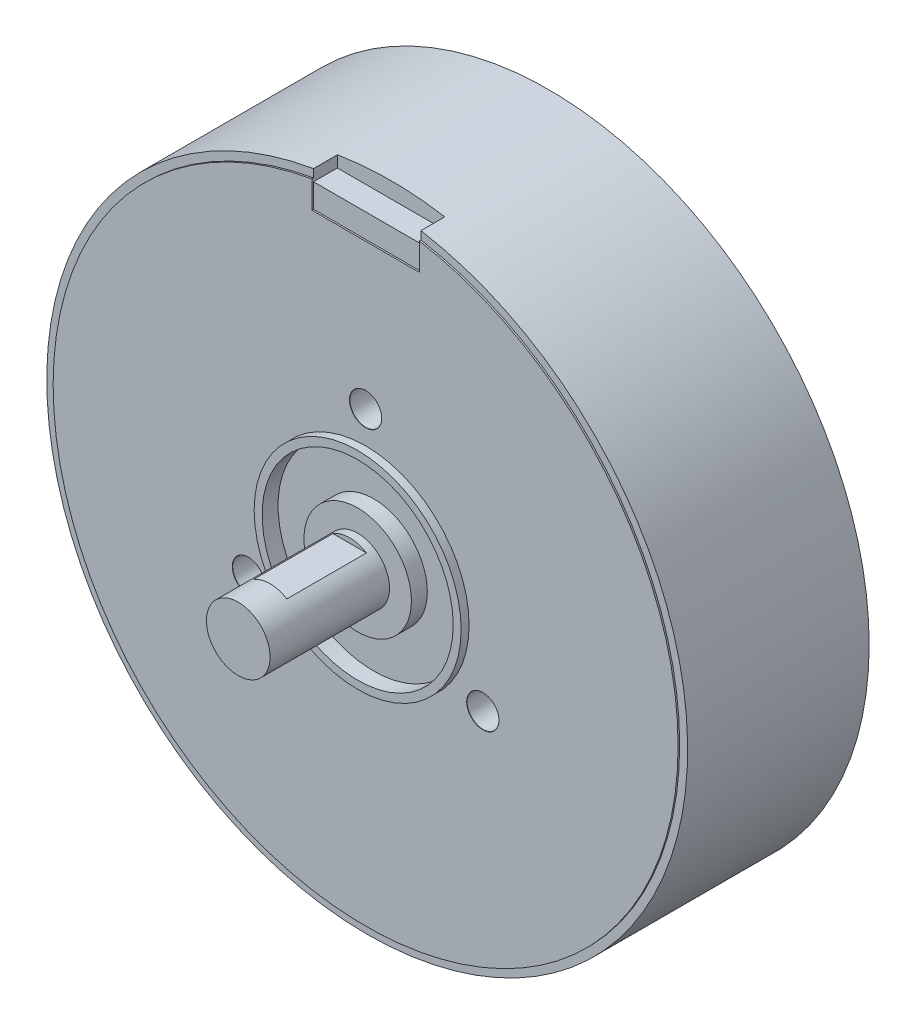
from build123d import *

# Parameters (mm, degrees)
SKETCH1_R                       = 40.25
BOSS_EXTRUDE1_DEPTH             = 23
SKETCH2_R                       = 12
CUT_EXTRUDE1_DEPTH              = 1
BOSS_EXTRUDE2_START             = 1
SKETCH3_R                       = 13
SKETCH3_R_2                     = 12
BOSS_EXTRUDE2_DEPTH             = 1
SKETCH4_R                       = 6.75
BOSS_EXTRUDE3_DEPTH             = 2
SKETCH7_R                       = 4
BOSS_EXTRUDE5_DEPTH             = 1
BOSS_EXTRUDE6_DEPTH             = 11
SKETCH8_R                       = 4
BOSS_EXTRUDE7_DEPTH             = 4
CUT_EXTRUDE2_START              = -0.2
SKETCH9_R                       = 40.25
SKETCH9_R_2                     = 39.25
CUT_EXTRUDE2_DEPTH              = 0.2
CUT_EXTRUDE4_START              = -0.2
CUT_EXTRUDE4_DEPTH              = 0.2
CUT_EXTRUDE5_START              = -3
CUT_EXTRUDE5_DEPTH              = 3
F_4_0MM_DOWEL_HOLE1_D           = 4
F_4_0MM_DOWEL_HOLE1_DEPTH       = 5.5
F_4_0MM_DOWEL_HOLE1_CSINK_D     = 4.05
F_4_0MM_DOWEL_HOLE1_CSINK_ANGLE = 90
F_4_0MM_DOWEL_HOLE1_TIP         = 1.201721238


with BuildPart() as part:
    # Sketch1 → Boss-Extrude1 (new body)
    with BuildSketch(Plane.XY):
        Circle(SKETCH1_R)
    extrude(amount=BOSS_EXTRUDE1_DEPTH)

    # Sketch2 → Cut-Extrude1 (cut)
    with BuildSketch(Plane.XY.offset(23)):
        Circle(SKETCH2_R)
    extrude(amount=-CUT_EXTRUDE1_DEPTH, mode=Mode.SUBTRACT)

    # Sketch3 → Boss-Extrude2 (add)
    with BuildSketch(Plane.XY.offset(23).offset(BOSS_EXTRUDE2_START)):
        Circle(SKETCH3_R)
        Circle(SKETCH3_R_2, mode=Mode.SUBTRACT)
    extrude(amount=-BOSS_EXTRUDE2_DEPTH)

    # Sketch4 → Boss-Extrude3 (add)
    with BuildSketch(Plane.XY.offset(22)):
        Circle(SKETCH4_R)
    extrude(amount=BOSS_EXTRUDE3_DEPTH)

    # Sketch7 → Boss-Extrude5 (add)
    with BuildSketch(Plane.XY.offset(24)):
        Circle(SKETCH7_R)
    extrude(amount=BOSS_EXTRUDE5_DEPTH)

    # Sketch5 → Boss-Extrude6 (add)
    with BuildSketch(Plane.XY.offset(24)):
        with BuildLine():
            Line((0, 0), (0, -4))
            ThreePointArc((0, -4), (2.828427125, -2.828427125), (4, 0))
            Line((4, 0), (0, 0))
        make_face()
        with BuildLine():
            Line((0, 3.4), (0, 0))
            Line((0, 0), (4, 0))
            ThreePointArc((4, 0), (3.494890771, 1.945697433), (2.107130751, 3.4))
            Line((2.107130751, 3.4), (0, 3.4))
        make_face()
        with BuildLine():
            Line((-3.4, 0), (0, 0))
            Line((0, 0), (0, 3.4))
            Line((0, 3.4), (-2.107130751, 3.4))
            ThreePointArc((-2.107130751, 3.4), (-2.828427125, 2.828427125), (-3.4, 2.107130751))
            Line((-3.4, 2.107130751), (-3.4, 0))
        make_face()
        with BuildLine():
            ThreePointArc((-3.4, -2.107130751), (-1.945697433, -3.494890771), (0, -4))
            Line((0, -4), (0, 0))
            Line((0, 0), (-3.4, 0))
            Line((-3.4, 0), (-3.4, -2.107130751))
        make_face()
    extrude(amount=BOSS_EXTRUDE6_DEPTH)

    # Sketch8 → Boss-Extrude7 (add)
    with BuildSketch(Plane.XY.offset(35)):
        Circle(SKETCH8_R)
    extrude(amount=BOSS_EXTRUDE7_DEPTH)

    # Sketch9 → Cut-Extrude2 (cut)
    with BuildSketch(Plane.XY.offset(23).offset(CUT_EXTRUDE2_START)):
        Circle(SKETCH9_R)
        Circle(SKETCH9_R_2, mode=Mode.SUBTRACT)
    extrude(amount=CUT_EXTRUDE2_DEPTH, mode=Mode.SUBTRACT)

    # Sketch11 → Cut-Extrude4 (cut)
    with BuildSketch(Plane.XY.offset(23).offset(CUT_EXTRUDE4_START)):
        with BuildLine():
            ThreePointArc((6.75, 38.665229858), (3.387641367, 39.103534188), (0, 39.25))
            Line((0, 39.25), (0, 35.25))
            Line((0, 35.25), (6.75, 35.25))
            Line((6.75, 35.25), (6.75, 38.665229858))
        make_face()
        with BuildLine():
            Line((0, 35.25), (0, 39.25))
            ThreePointArc((0, 39.25), (-3.387641367, 39.103534188), (-6.75, 38.665229858))
            Line((-6.75, 38.665229858), (-6.75, 35.25))
            Line((-6.75, 35.25), (0, 35.25))
        make_face()
    extrude(amount=CUT_EXTRUDE4_DEPTH, mode=Mode.SUBTRACT)

    # Sketch12 → Cut-Extrude5 (cut)
    with BuildSketch(Plane.XY.offset(22.8).offset(CUT_EXTRUDE5_START)):
        with BuildLine():
            Line((-6.75, 38.25), (6.75, 38.25))
            Line((6.75, 38.25), (6.75, 38.665229858))
            Line((6.75, 38.665229858), (6.75, 39.679969758))
            ThreePointArc((6.75, 39.679969758), (3.820610596, 40.068259691), (0.870628209, 40.24058283))
            Line((0.870628209, 40.24058283), (-0.870628209, 40.24058283))
            ThreePointArc((-0.870628209, 40.24058283), (-3.820610596, 40.068259691), (-6.75, 39.679969758))
            Line((-6.75, 39.679969758), (-6.75, 38.665229858))
            Line((-6.75, 38.665229858), (-6.75, 38.25))
        make_face()
        with BuildLine():
            Line((-0.870628209, 40.24058283), (0.870628209, 40.24058283))
            ThreePointArc((0.870628209, 40.24058283), (0, 40.25), (-0.870628209, 40.24058283))
        make_face()
    extrude(amount=CUT_EXTRUDE5_DEPTH, mode=Mode.SUBTRACT)

    # Ø4.0mm Dowel Hole1
    with Locations(Plane.XY.offset(23)):
        with Locations((0, 17), (14.722431864, -8.5), (-14.722431864, -8.5)):
            CounterSinkHole(F_4_0MM_DOWEL_HOLE1_D / 2, F_4_0MM_DOWEL_HOLE1_CSINK_D / 2, depth=F_4_0MM_DOWEL_HOLE1_DEPTH, counter_sink_angle=F_4_0MM_DOWEL_HOLE1_CSINK_ANGLE)
            with Locations((0, 0, -(F_4_0MM_DOWEL_HOLE1_DEPTH + F_4_0MM_DOWEL_HOLE1_TIP / 2))):  # 118° drill point
                Cone(0, F_4_0MM_DOWEL_HOLE1_D / 2, F_4_0MM_DOWEL_HOLE1_TIP, mode=Mode.SUBTRACT)


solid = part.part
